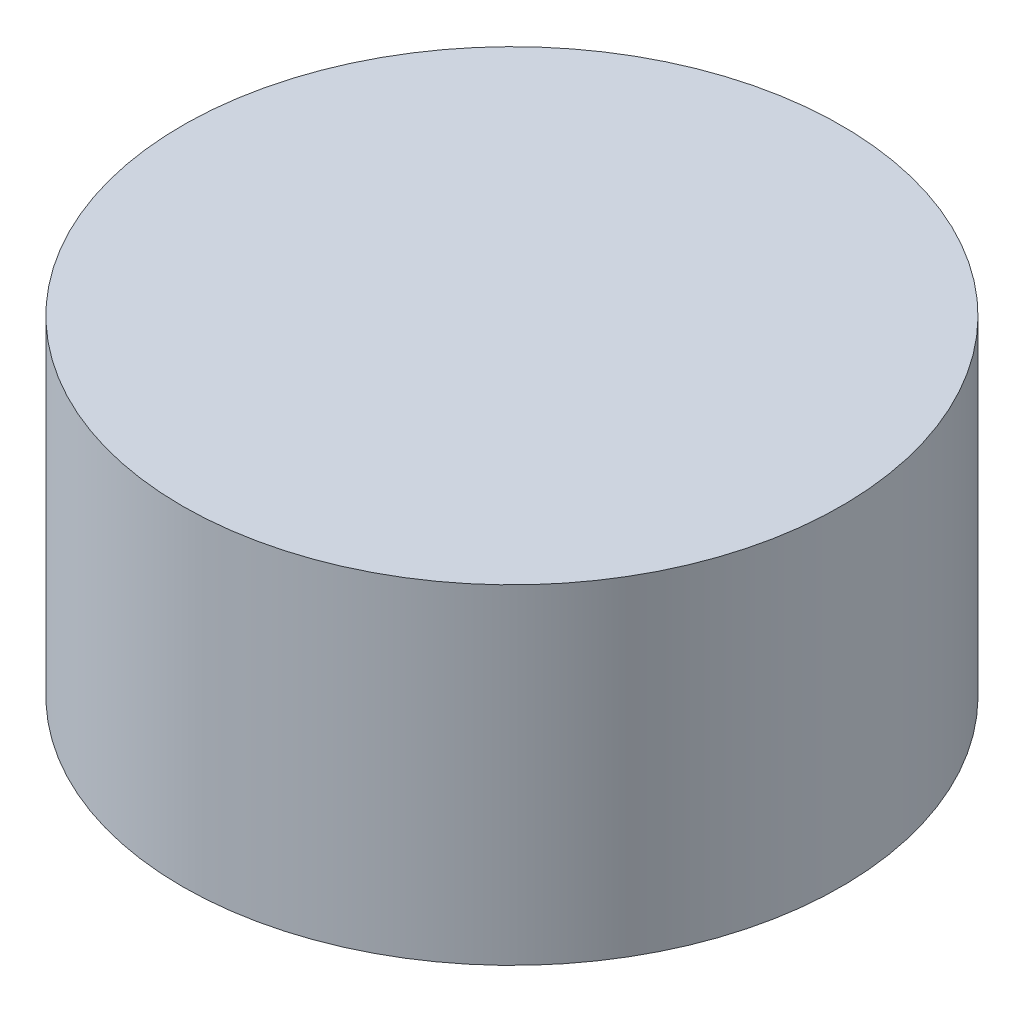
from build123d import *

# Parameters (mm, degrees)
SKETCH1_R           = 63.5
BOSS_EXTRUDE1_DEPTH = 63.5


with BuildPart() as part:
    # Sketch1 → Boss-Extrude1 (new body)
    with BuildSketch(Plane(origin=(0, 0, 0), x_dir=(1, 0, 0), z_dir=(0, 1, 0))):
        with Locations(Location((0, 0, 0), (0, 0, 270))):
            Circle(SKETCH1_R)
    extrude(amount=BOSS_EXTRUDE1_DEPTH)


solid = part.part
